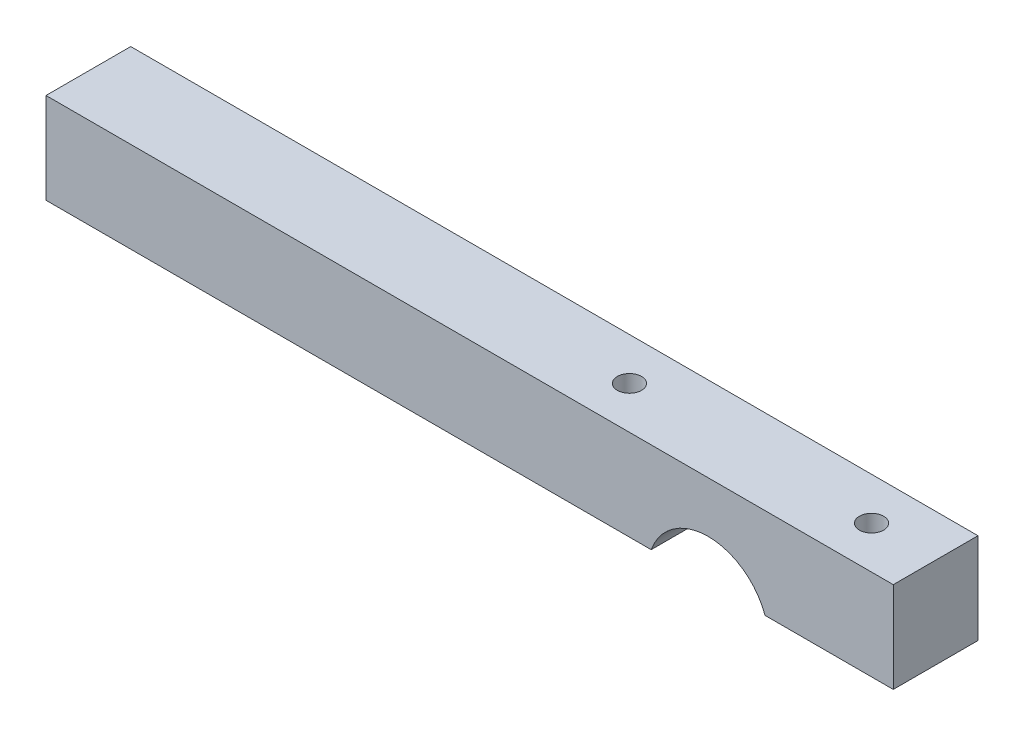
from build123d import *

# Parameters (mm, degrees)
BOSS_EXTRUDE1_DEPTH = 14
CUT_EXTRUDE1_REACH  = 113.314
SKETCH4_R           = 2


with BuildPart() as part:
    # Sketch2 → Boss-Extrude1 (new body)
    with BuildSketch(Plane.XY):
        with BuildLine():
            Line((9.406636819, 3.393402975), (30.593363181, 3.393402975))
            Line((30.593363181, 3.393402975), (30.593363181, 18.393402975))
            Line((30.593363181, 18.393402975), (-109.406636819, 18.393402975))
            Line((-109.406636819, 18.393402975), (-109.406636819, 3.393402975))
            Line((-109.406636819, 3.393402975), (-9.406636819, 3.393402975))
            ThreePointArc((-9.406636819, 3.393402975), (0, 10), (9.406636819, 3.393402975))
        make_face()
    extrude(amount=BOSS_EXTRUDE1_DEPTH)

    # Sketch4 → Cut-Extrude1 (cut, up to next)
    with BuildSketch(Plane(origin=(0, 18.393402975, 0), x_dir=(1, 0, 0), z_dir=(0, 1, 0)), mode=Mode.PRIVATE) as cut_extrude1_sk1:
        with Locations(Location((20, -7, 0), (0, 0, 180))):
            Circle(SKETCH4_R)
    cut_extrude1_tool1 = extrude(cut_extrude1_sk1.sketch, amount=-CUT_EXTRUDE1_REACH, mode=Mode.PRIVATE) & part.part
    # Sketch4 → Cut-Extrude1 (cut, up to next)
    with BuildSketch(Plane(origin=(0, 18.393402975, 0), x_dir=(1, 0, 0), z_dir=(0, 1, 0)), mode=Mode.PRIVATE) as cut_extrude1_sk2:
        with Locations(Location((-20, -7, 0), (0, 0, 180))):
            Circle(SKETCH4_R)
    cut_extrude1_tool2 = extrude(cut_extrude1_sk2.sketch, amount=-CUT_EXTRUDE1_REACH, mode=Mode.PRIVATE) & part.part
    add(cut_extrude1_tool1.solids().sort_by_distance((20, 18.393403, 7))[0], mode=Mode.SUBTRACT)
    add(cut_extrude1_tool2.solids().sort_by_distance((-20, 18.393403, 7))[0], mode=Mode.SUBTRACT)


solid = part.part
